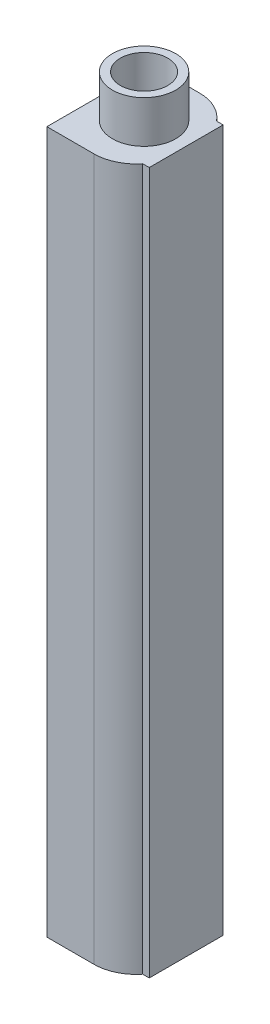
from build123d import *

# Parameters (mm, degrees)
BOSS_EXTRUDE1_DEPTH = 1.5
BOSS_EXTRUDE2_START = 131.6
BOSS_EXTRUDE2_DEPTH = 131.6
BOSS_EXTRUDE3_DEPTH = 1.5
SKETCH4_R           = 6
SKETCH4_R_2         = 4.5
BOSS_EXTRUDE4_DEPTH = 8
CUT_EXTRUDE2_START  = -8
SKETCH6_R           = 4.5
CUT_EXTRUDE2_DEPTH  = 8


with BuildPart() as part:
    # Sketch1 → Boss-Extrude1 (new body)
    with BuildSketch(Plane(origin=(0, 0, 0), x_dir=(1, 0, 0), z_dir=(0, 1, 0))):
        with BuildLine():
            Line((-16.414997998, 3), (-16.414997998, -17))
            Line((-16.414997998, -17), (-7.484997998, -17))
            ThreePointArc((-7.484997998, -17), (-4.020896383, -16.211102551), (-1.24, -14))
            Line((-1.24, -14), (0, -14))
            Line((0, -14), (0, 0))
            Line((0, 0), (-1.24, 0))
            ThreePointArc((-1.24, 0), (-4.020896383, 2.211102551), (-7.484997998, 3))
            Line((-7.484997998, 3), (-16.414997998, 3))
        make_face()
    extrude(amount=-BOSS_EXTRUDE1_DEPTH)

    # Sketch2 → Boss-Extrude2 (add)
    with BuildSketch(Plane(origin=(0, 0, 0), x_dir=(1, 0, 0), z_dir=(0, 1, 0)).offset(BOSS_EXTRUDE2_START)):
        with BuildLine():
            Line((-16.414997998, 3), (-16.414997998, -17))
            Line((-16.414997998, -17), (-7.484997998, -17))
            ThreePointArc((-7.484997998, -17), (-4.020896383, -16.211102551), (-1.24, -14))
            Line((-1.24, -14), (0, -14))
            Line((0, -14), (0, 0))
            Line((0, 0), (-1.24, 0))
            ThreePointArc((-1.24, 0), (-4.020896383, 2.211102551), (-7.484997998, 3))
            Line((-7.484997998, 3), (-16.414997998, 3))
        make_face()
        with BuildLine():
            Line((-7.484997998, 1.5), (-14.914997998, 1.5))
            Line((-14.914997998, 1.5), (-14.914997998, -15.5))
            Line((-14.914997998, -15.5), (-7.484997998, -15.5))
            ThreePointArc((-7.484997998, -15.5), (-4.362498999, -14.700877125), (-2.007772423, -12.5))
            Line((-2.007772423, -12.5), (-1.5, -12.5))
            Line((-1.5, -12.5), (-1.5, -1.5))
            Line((-1.5, -1.5), (-2.007772423, -1.5))
            ThreePointArc((-2.007772423, -1.5), (-4.362498999, 0.700877125), (-7.484997998, 1.5))
        make_face(mode=Mode.SUBTRACT)
    extrude(amount=-BOSS_EXTRUDE2_DEPTH)

    # Sketch3 → Boss-Extrude3 (add)
    with BuildSketch(Plane(origin=(0, 131.6, 0), x_dir=(1, 0, 0), z_dir=(0, 1, 0))):
        with BuildLine():
            Line((-7.484997998, 3), (-16.414997998, 3))
            Line((-16.414997998, 3), (-16.414997998, -17))
            Line((-16.414997998, -17), (-7.484997998, -17))
            ThreePointArc((-7.484997998, -17), (-4.020896383, -16.211102551), (-1.24, -14))
            Line((-1.24, -14), (0, -14))
            Line((0, -14), (0, 0))
            Line((0, 0), (-1.24, 0))
            ThreePointArc((-1.24, 0), (-4.020896383, 2.211102551), (-7.484997998, 3))
        make_face()
    extrude(amount=-BOSS_EXTRUDE3_DEPTH)

    # Sketch4 → Boss-Extrude4 (add)
    with BuildSketch(Plane(origin=(0, 131.6, 0), x_dir=(1, 0, 0), z_dir=(0, 1, 0))):
        with Locations(Location((-8.207498999, -6.780386744, 0), (0, 0, 270))):
            Circle(SKETCH4_R)
        with Locations(Location((-8.207498999, -6.780386744, 0), (0, 0, 270))):
            Circle(SKETCH4_R_2, mode=Mode.SUBTRACT)
    extrude(amount=BOSS_EXTRUDE4_DEPTH)

    # Sketch6 → Cut-Extrude2 (cut)
    with BuildSketch(Plane(origin=(0, 131.6, 0), x_dir=(1, 0, 0), z_dir=(0, 1, 0)).offset(CUT_EXTRUDE2_START)):
        with Locations(Location((-8.207498999, -6.780386744, 0), (0, 0, 270))):
            Circle(SKETCH6_R)
    extrude(amount=CUT_EXTRUDE2_DEPTH, mode=Mode.SUBTRACT)


solid = part.part
